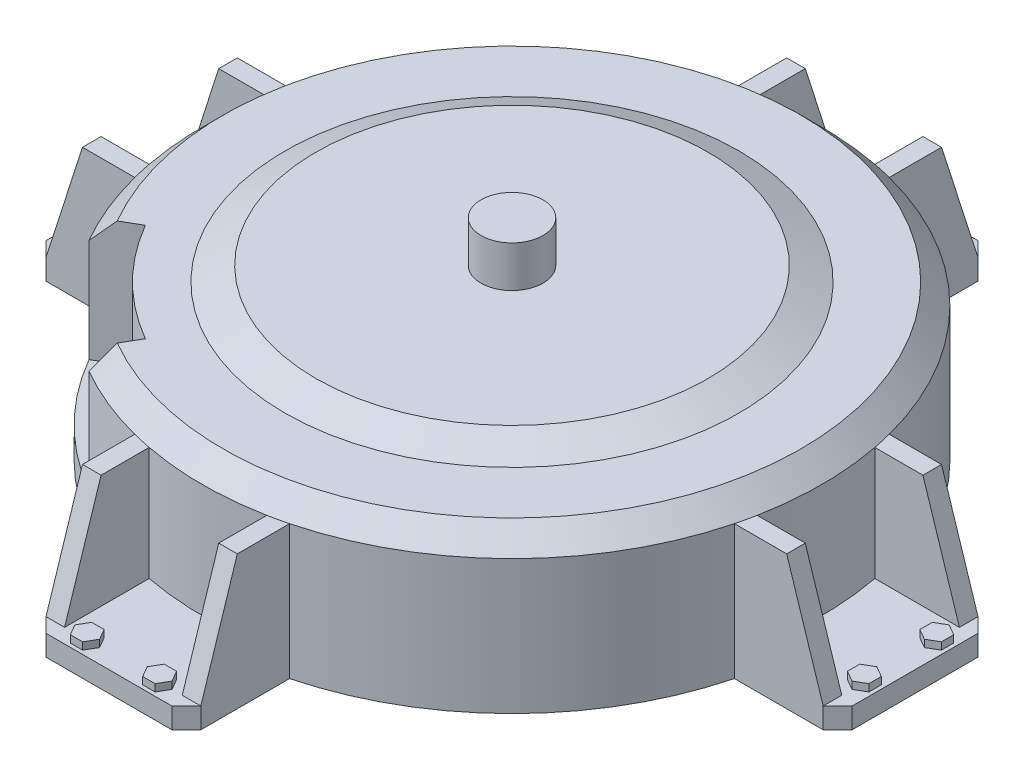
from build123d import *

# Parameters (mm, degrees)
SKETCH1_R                    = 150
BOSS_EXTRUDE1_DEPTH          = 75
CHAMFER1_SIZE                = 10
BOSS_EXTRUDE2_DEPTH          = 10
CHAMFER2_SIZE                = 7
BOSS_EXTRUDE3_DEPTH          = 9
BOSS_EXTRUDE4_DEPTH          = 3.5
CIRPATTERN1_COUNT            = 4
CIRPATTERN1_COPY_1_DEPTH     = 9
CIRPATTERN1_COPY_2_DEPTH     = 9
CIRPATTERN1_COPY_3_DEPTH     = 9
CIRPATTERN1_COPY_4_DEPTH     = 3.5
CIRPATTERN1_COPY_5_DEPTH     = 3.5
CIRPATTERN1_COPY_6_DEPTH     = 3.5
CHAMFER2_OF_CIRPATTERN1_SIZE = 7
CUT_EXTRUDE1_START           = -60
CUT_EXTRUDE1_DEPTH           = 60
SKETCH7_R                    = 110
SKETCH8_R                    = 95
SKETCH9_R                    = 15
BOSS_EXTRUDE5_DEPTH          = 20


with BuildPart() as part:
    # Sketch1 → Boss-Extrude1 (new body)
    with BuildSketch(Plane(origin=(0, 0, 0), x_dir=(1, 0, 0), z_dir=(0, 1, 0))):
        with Locations(Location((0, 0, 0), (0, 0, 270))):
            Circle(SKETCH1_R)
    extrude(amount=BOSS_EXTRUDE1_DEPTH)

    # Chamfer1
    chamfer1_edges = [part.edges().sort_by_distance(p)[0] for p in [
        (0, 75, -150),
    ]]
    chamfer(chamfer1_edges, length=CHAMFER1_SIZE)

    # Sketch2 → Boss-Extrude2 (add)
    with BuildSketch(Plane(origin=(0, 0, 0), x_dir=(-1, 0, 0), z_dir=(0, -1, 0))):
        with BuildLine():
            Line((145.236875483, 37.5), (195.236875483, 37.5))
            Line((195.236875483, 37.5), (195.236875483, -37.5))
            Line((195.236875483, -37.5), (145.236875483, -37.5))
            ThreePointArc((145.236875483, -37.5), (150, 0), (145.236875483, 37.5))
        make_face()
    boss_extrude2 = extrude(amount=-BOSS_EXTRUDE2_DEPTH)

    # Chamfer2
    chamfer2_edges = [part.edges().sort_by_distance(p)[0] for p in [
        (-195.236875483, 5, -37.5),
        (-195.236875483, 5, 37.5),
    ]]
    chamfer(chamfer2_edges, length=CHAMFER2_SIZE)

    # Sketch3 → Boss-Extrude3 (add)
    with BuildSketch(Plane.XY.offset(37.5)):
        Polygon((-145.236875483, 10), (-145.236875483, 65), (-170.556875483, 65), (-188.236875483, 10), align=None)
    boss_extrude3 = extrude(amount=-BOSS_EXTRUDE3_DEPTH)

    # Sketch4 → Boss-Extrude4 (add)
    with BuildSketch(Plane(origin=(0, 10, 0), x_dir=(1, 0, 0), z_dir=(0, 1, 0))):
        Polygon((-188.236875483, -23.54), (-183.04072306, -20.54), (-183.04072306, -14.54), (-188.236875483, -11.54), (-193.433027905, -14.54), (-193.433027905, -20.54), align=None)
    boss_extrude4 = extrude(amount=BOSS_EXTRUDE4_DEPTH)

    # Mirror1: Boss-Extrude3, Boss-Extrude4 across plane
    add(boss_extrude3.mirror(Plane.XY))
    add(boss_extrude4.mirror(Plane.XY))

    # CirPattern1: Boss-Extrude2, Boss-Extrude3, Boss-Extrude4 ×4 about axis
    cirpattern1_axis = Axis((0, 0, 0), (0, 1, 0))
    add([boss_extrude2.rotate(cirpattern1_axis, i * 360 / CIRPATTERN1_COUNT) for i in range(1, CIRPATTERN1_COUNT)])
    add([boss_extrude3.rotate(cirpattern1_axis, i * 360 / CIRPATTERN1_COUNT) for i in range(1, CIRPATTERN1_COUNT)])
    add([boss_extrude4.rotate(cirpattern1_axis, i * 360 / CIRPATTERN1_COUNT) for i in range(1, CIRPATTERN1_COUNT)])

    # CirPattern1 copy 1 sketch → CirPattern1 copy 1 (add)
    with BuildSketch(Plane(origin=(-37.5, 0, 0), x_dir=(0, 0, -1), z_dir=(-1, 0, 0))):
        Polygon((-145.236875483, -10), (-145.236875483, -65), (-170.556875483, -65), (-188.236875483, -10), align=None)
    extrude(amount=-CIRPATTERN1_COPY_1_DEPTH)

    # CirPattern1 copy 2 sketch → CirPattern1 copy 2 (add)
    with BuildSketch(Plane(origin=(0, 0, 37.5), x_dir=(-1, 0, 0), z_dir=(0, 0, 1))):
        Polygon((-145.236875483, -10), (-145.236875483, -65), (-170.556875483, -65), (-188.236875483, -10), align=None)
    extrude(amount=-CIRPATTERN1_COPY_2_DEPTH)

    # CirPattern1 copy 3 sketch → CirPattern1 copy 3 (add)
    with BuildSketch(Plane(origin=(37.5, 0, 0), x_dir=(0, 0, 1), z_dir=(1, 0, 0))):
        Polygon((-145.236875483, -10), (-145.236875483, -65), (-170.556875483, -65), (-188.236875483, -10), align=None)
    extrude(amount=-CIRPATTERN1_COPY_3_DEPTH)

    # CirPattern1 copy 4 sketch → CirPattern1 copy 4 (add)
    with BuildSketch(Plane(origin=(0, 10, 0), x_dir=(0, 0, -1), z_dir=(0, 1, 0))):
        Polygon((-188.236875483, 23.54), (-183.04072306, 20.54), (-183.04072306, 14.54), (-188.236875483, 11.54), (-193.433027905, 14.54), (-193.433027905, 20.54), align=None)
    extrude(amount=CIRPATTERN1_COPY_4_DEPTH)

    # CirPattern1 copy 5 sketch → CirPattern1 copy 5 (add)
    with BuildSketch(Plane(origin=(0, 10, 0), x_dir=(-1, 0, 0), z_dir=(0, 1, 0))):
        Polygon((-188.236875483, 23.54), (-183.04072306, 20.54), (-183.04072306, 14.54), (-188.236875483, 11.54), (-193.433027905, 14.54), (-193.433027905, 20.54), align=None)
    extrude(amount=CIRPATTERN1_COPY_5_DEPTH)

    # CirPattern1 copy 6 sketch → CirPattern1 copy 6 (add)
    with BuildSketch(Plane.ZX.offset(10)):
        Polygon((-188.236875483, 23.54), (-183.04072306, 20.54), (-183.04072306, 14.54), (-188.236875483, 11.54), (-193.433027905, 14.54), (-193.433027905, 20.54), align=None)
    extrude(amount=CIRPATTERN1_COPY_6_DEPTH)

    # Chamfer2 of CirPattern1
    chamfer2_of_cirpattern1_edges = [part.edges().sort_by_distance(p)[0] for p in [
        (-37.5, 5, 195.236875483),
        (37.5, 5, 195.236875483),
        (195.236875483, 5, 37.5),
        (195.236875483, 5, -37.5),
        (37.5, 5, -195.236875483),
        (-37.5, 5, -195.236875483),
    ]]
    chamfer(chamfer2_of_cirpattern1_edges, length=CHAMFER2_OF_CIRPATTERN1_SIZE)

    # Sketch6 → Cut-Extrude1 (cut)
    with BuildSketch(Plane(origin=(0, 75, 0), x_dir=(1, 0, 0), z_dir=(0, 1, 0)).offset(CUT_EXTRUDE1_START)):
        with BuildLine():
            Line((-112.583302492, -65), (-129.903810568, -75))
            ThreePointArc((-129.903810568, -75), (-106.066017178, -106.066017178), (-75, -129.903810568))
            Line((-75, -129.903810568), (-65, -112.583302492))
            ThreePointArc((-65, -112.583302492), (-91.923881554, -91.923881554), (-112.583302492, -65))
        make_face()
    extrude(amount=CUT_EXTRUDE1_DEPTH, mode=Mode.SUBTRACT)

    # Sketch7 → Loft1 section 0
    with BuildSketch(Plane(origin=(0, 75, 0), x_dir=(1, 0, 0), z_dir=(0, 1, 0))):
        Circle(SKETCH7_R)
    # Sketch8 → Loft1 section 1
    with BuildSketch(Plane(origin=(0, 82, 0), x_dir=(1, 0, 0), z_dir=(0, 1, 0))):
        Circle(SKETCH8_R)
    loft()

    # Sketch9 → Boss-Extrude5 (add)
    with BuildSketch(Plane(origin=(0, 82, 0), x_dir=(1, 0, 0), z_dir=(0, 1, 0))):
        with Locations(Location((0, 0, 0), (0, 0, 270))):
            Circle(SKETCH9_R)
    extrude(amount=BOSS_EXTRUDE5_DEPTH)


solid = part.part
